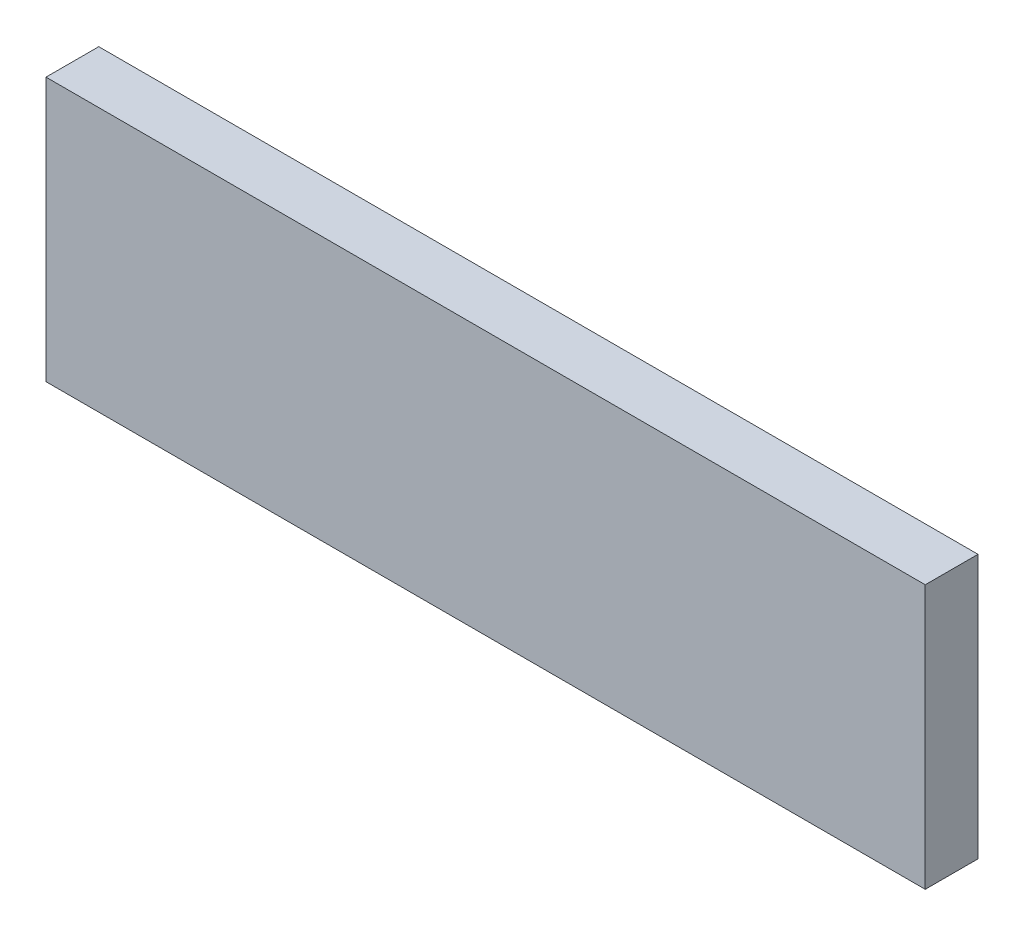
from build123d import *

# Parameters (mm, degrees)
SKETCH1_W           = 100
SKETCH1_H           = 30
BOSS_EXTRUDE1_DEPTH = 6


with BuildPart() as part:
    # Sketch1 → Boss-Extrude1 (new body)
    with BuildSketch(Plane.XY):
        with Locations((50, 15)):
            Rectangle(SKETCH1_W, SKETCH1_H)
    extrude(amount=BOSS_EXTRUDE1_DEPTH)


solid = part.part
